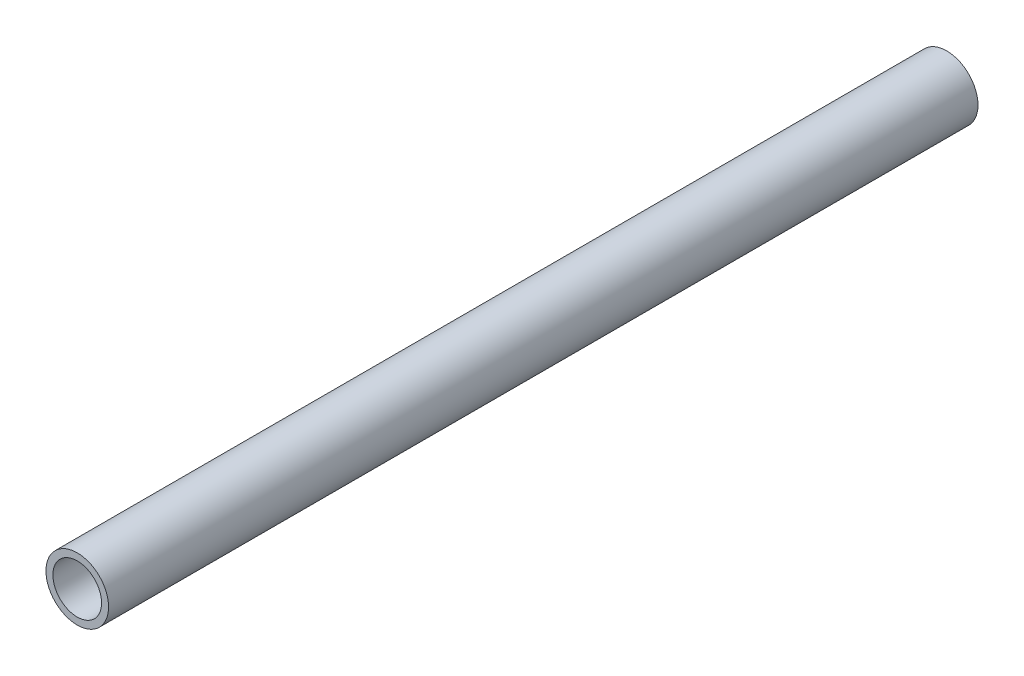
from build123d import *

# Parameters (mm, degrees)
SKETCH3_R           = 4.5
SKETCH3_R_2         = 3.5
BOSS_EXTRUDE1_DEPTH = 150
SKETCH4_R           = 4.5
CUT_EXTRUDE1_DEPTH  = 175


with BuildPart() as part:
    # Sketch3 → Boss-Extrude1 (new, symmetric)
    with BuildSketch(Plane.XY):
        Circle(SKETCH3_R)
        Circle(SKETCH3_R_2, mode=Mode.SUBTRACT)
    extrude(amount=BOSS_EXTRUDE1_DEPTH, both=True)

    # Sketch4 → Cut-Extrude1 (cut)
    with BuildSketch(Plane.XY.offset(150)):
        Circle(SKETCH4_R)
    extrude(amount=-CUT_EXTRUDE1_DEPTH, mode=Mode.SUBTRACT)


solid = part.part
